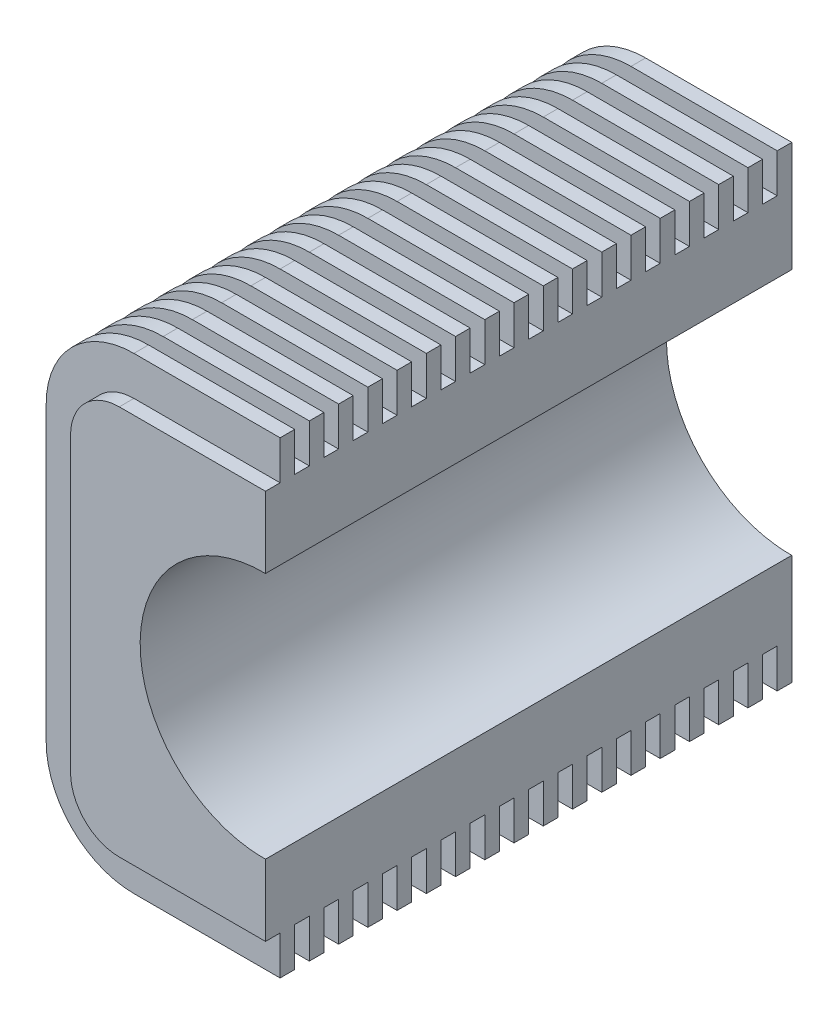
from build123d import *

# Parameters (mm, degrees)
DODANIE_WYCI_GNI_CIE1_DEPTH = 108
SZKIC2_RX                   = 25.386309132
SZKIC2_RY                   = 25.359618568
WYTNIJ_WYCI_GNI_CIE1_DEPTH  = 138.437258413
DODANIE_WYCI_GNI_CIE2_DEPTH = 3
SZYK_LINIOWY1_COUNT         = 18
SZYK_LINIOWY1_PITCH         = 6


with BuildPart() as part:
    # Szkic1 → Dodanie-wyciągnięcie1 (new body)
    with BuildSketch(Plane.XY):
        with BuildLine():
            Line((0, 75), (-30, 75))
            ThreePointArc((-30, 75), (-37.071067812, 72.071067812), (-40, 65))
            Line((-40, 65), (-40, 5))
            ThreePointArc((-40, 5), (-37.071067812, -2.071067812), (-30, -5))
            Line((-30, -5), (0, -5))
            Line((0, -5), (0, 75))
        make_face()
    extrude(amount=DODANIE_WYCI_GNI_CIE1_DEPTH)

    # Szkic2 → Wytnij-wyciągnięcie1 (cut, through all)
    with BuildSketch(Plane.XY.offset(108)):
        with Locations(Location((-0.359618568, 35), (0, 0, -90))):
            Ellipse(SZKIC2_RX, SZKIC2_RY)
    extrude(amount=-WYTNIJ_WYCI_GNI_CIE1_DEPTH, mode=Mode.SUBTRACT)

    # Szkic3 → Dodanie-wyciągnięcie2 (add)
    with BuildSketch(Plane.XY):
        with BuildLine():
            Line((0, 75), (0, 83))
            Line((0, 83), (-30, 83))
            ThreePointArc((-30, 83), (-42.727922061, 77.727922061), (-48, 65))
            Line((-48, 65), (-48, 5))
            ThreePointArc((-48, 5), (-42.727922061, -7.727922061), (-30, -13))
            Line((-30, -13), (0, -13))
            Line((0, -13), (0, -5))
            Line((0, -5), (-30, -5))
            ThreePointArc((-30, -5), (-37.071067812, -2.071067812), (-40, 5))
            Line((-40, 5), (-40, 65))
            ThreePointArc((-40, 65), (-37.071067812, 72.071067812), (-30, 75))
            Line((-30, 75), (0, 75))
        make_face()
    dodanie_wyci_gni_cie2 = extrude(amount=DODANIE_WYCI_GNI_CIE2_DEPTH)

    # Szyk liniowy1: Dodanie-wyciągnięcie2 ×18
    with Locations(*[(0, 0, i * SZYK_LINIOWY1_PITCH) for i in range(1, SZYK_LINIOWY1_COUNT)]):
        add(dodanie_wyci_gni_cie2)


solid = part.part
